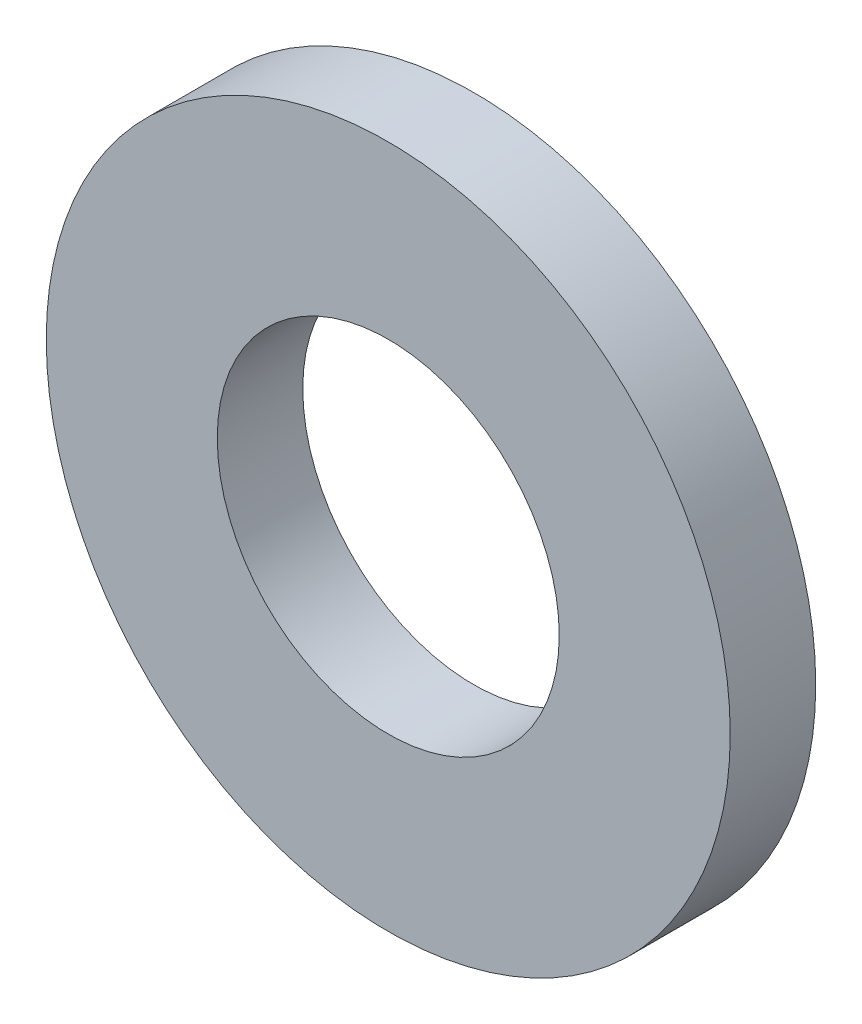
from build123d import *

# Parameters (mm, degrees)
SKETCH_1_R      = 2
SKETCH_1_R_2    = 1
EXTRUDE_2_DEPTH = 0.5


with BuildPart() as part:
    # Эскиз1 → Бобышка-Вытянуть2 (new body)
    with BuildSketch(Plane.XY):
        Circle(SKETCH_1_R)
        Circle(SKETCH_1_R_2, mode=Mode.SUBTRACT)
    extrude(amount=EXTRUDE_2_DEPTH)


solid = part.part
